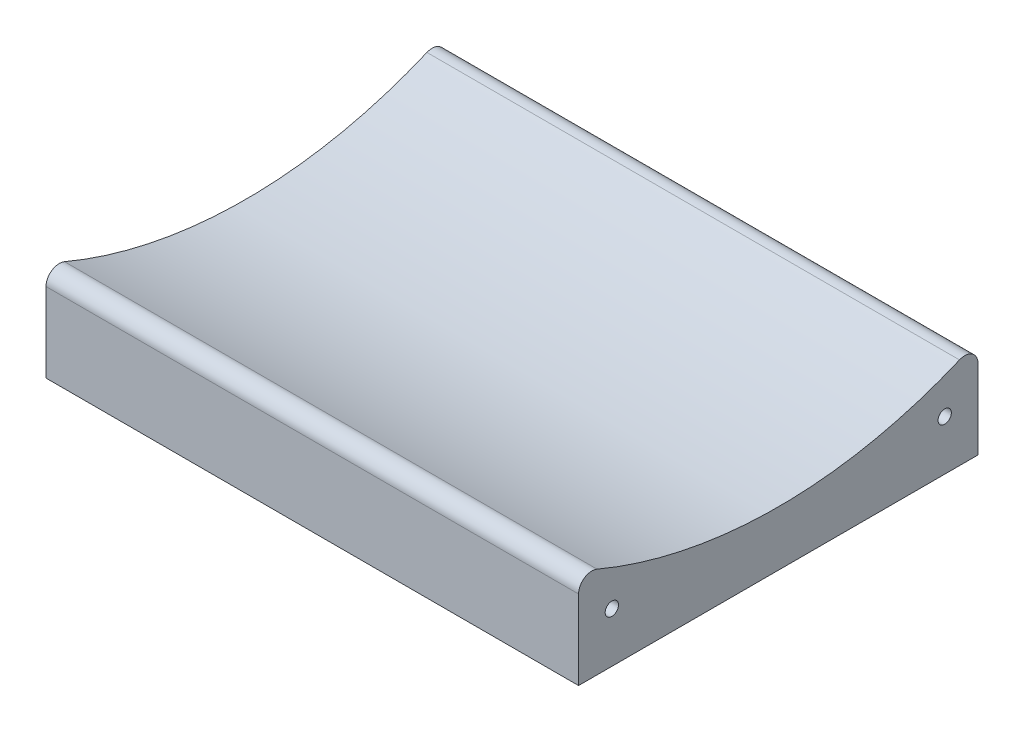
from build123d import *

# Parameters (mm, degrees)
EXTRUDE_1_DEPTH     = 80
FILLET_1_R          = 2
SKETCH_2_R          = 1
CUT_EXTRUDE_1_DEPTH = 5


with BuildPart() as part:
    # 草图1 → 凸台-拉伸1 (new body)
    with BuildSketch(Plane(origin=(0, 0, 0), x_dir=(0, 0, -1), z_dir=(1, 0, 0))):
        with BuildLine():
            Line((-30, 0), (30, 0))
            Line((30, 0), (30, 15))
            ThreePointArc((30, 15), (0, 8.245553203), (-30, 15))
            Line((-30, 15), (-30, 0))
        make_face()
    extrude(amount=EXTRUDE_1_DEPTH)

    # 圆角1
    fillet_1_edges = [part.edges().sort_by_distance(p)[0] for p in [
        (40, 15, 30),
        (40, 15, -30),
    ]]
    fillet(fillet_1_edges, radius=FILLET_1_R)

    # 草图2 → 切除-拉伸1 (cut)
    with BuildSketch(Plane(origin=(80, 0, 0), x_dir=(0, 0, -1), z_dir=(1, 0, 0))):
        with Locations((-25, 7.5)):
            Circle(SKETCH_2_R)
        with Locations((25, 7.5)):
            Circle(SKETCH_2_R)
    cut_extrude_1 = extrude(amount=-CUT_EXTRUDE_1_DEPTH, mode=Mode.SUBTRACT)

    # 镜向1: 切除-拉伸1 across plane
    add(cut_extrude_1.mirror(Plane(origin=(40, 0, 0), x_dir=(0, 0, 1), z_dir=(1, 0, 0))), mode=Mode.SUBTRACT)


solid = part.part
